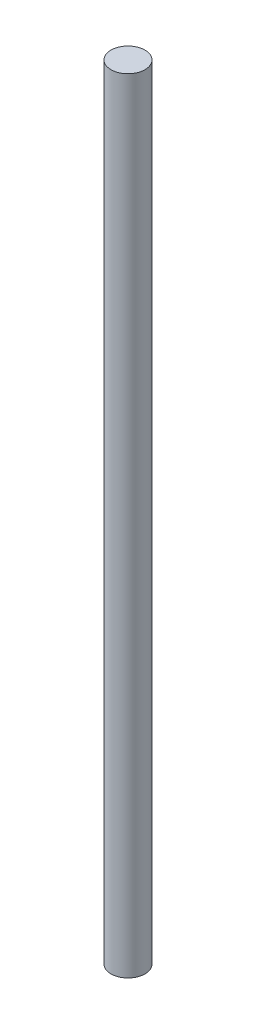
from build123d import *

# Parameters (mm, degrees)
SKETCH1_R           = 1.37795
BOSS_EXTRUDE1_DEPTH = 63.5


with BuildPart() as part:
    # Sketch1 → Boss-Extrude1 (new body)
    with BuildSketch(Plane(origin=(0, 0, 0), x_dir=(1, 0, 0), z_dir=(0, 1, 0))):
        with Locations(Location((0, 0, 0), (0, 0, 270))):
            Circle(SKETCH1_R)
    extrude(amount=BOSS_EXTRUDE1_DEPTH)


solid = part.part
